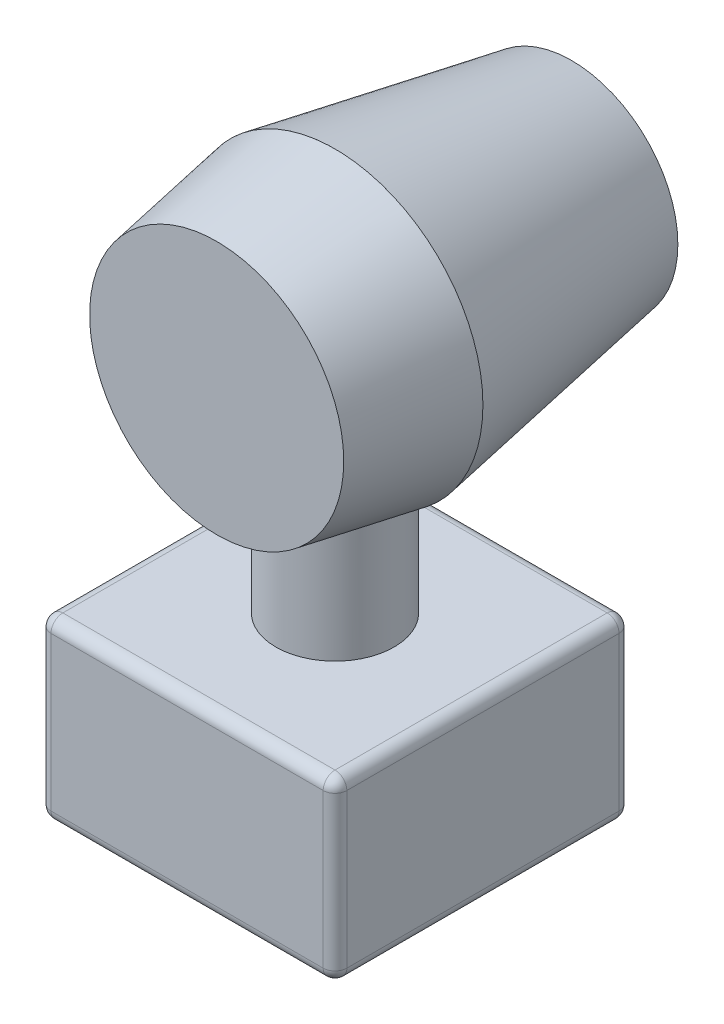
from build123d import *

# Parameters (mm, degrees)
SKETCH1_W           = 63.5
SKETCH1_H           = 38.1
BOSS_EXTRUDE1_DEPTH = 31.75
FILLET1_R           = 2.54
SKETCH2_R           = 12.7
BOSS_EXTRUDE2_DEPTH = 25.4
SKETCH3_R           = 31.75
BOSS_EXTRUDE3_DEPTH = 50.8
BOSS_EXTRUDE3_DRAFT = -10
SKETCH4_R           = 31.75
BOSS_EXTRUDE4_DEPTH = 25.4
BOSS_EXTRUDE4_TAPER = 10


with BuildPart() as part:
    # Sketch1 → Boss-Extrude1 (new, symmetric)
    with BuildSketch(Plane.XY):
        Rectangle(SKETCH1_W, SKETCH1_H)
    extrude(amount=BOSS_EXTRUDE1_DEPTH, both=True)

    # Fillet1
    fillet1_edges = [part.edges().sort_by_distance(p)[0] for p in [
        (-31.75, 0, 31.75),
        (0, -19.05, 31.75),
        (31.75, 0, 31.75),
        (0, -19.05, -31.75),
        (-31.75, 0, -31.75),
        (0, 19.05, -31.75),
        (31.75, 0, -31.75),
        (0, 19.05, 31.75),
        (31.75, -19.05, 0),
        (-31.75, -19.05, 0),
        (-31.75, 19.05, 0),
        (31.75, 19.05, 0),
    ]]
    fillet(fillet1_edges, radius=FILLET1_R)


with BuildPart() as body_2:
    # Sketch2 → Boss-Extrude2 (new body)
    with BuildSketch(Plane(origin=(0, 19.05, 0), x_dir=(-1, 0, 0), z_dir=(0, 1, 0))):
        with Locations(Location((0, 0, 0), (0, 0, 90))):
            Circle(SKETCH2_R)
    extrude(amount=BOSS_EXTRUDE2_DEPTH)


with BuildPart() as boss_extrude3_tool:
    # Sketch3 → Boss-Extrude3 (with draft: the straight prism first)
    with BuildSketch(Plane.XY):
        with Locations((0, 73.549355663)):
            Circle(SKETCH3_R)
    extrude(amount=-BOSS_EXTRUDE3_DEPTH)
    # Boss-Extrude3: the draft: its side faces are tilted about the plane it starts from
    boss_extrude3_sides = [boss_extrude3_tool.faces().sort_by_distance(p)[0] for p in [
        (-31.75, 73.549355663, -25.4),
    ]]
    draft(boss_extrude3_sides, Plane.XY, BOSS_EXTRUDE3_DRAFT)


with BuildPart() as body_2_1:
    add(body_2.part)

    # Boss-Extrude3: add boss_extrude3_tool
    add(boss_extrude3_tool.part)


with BuildPart() as body_3:
    # Sketch4 → Boss-Extrude4 (new body)
    with BuildSketch(Plane.XY):
        with Locations((0, 73.549355663)):
            Circle(SKETCH4_R)
    extrude(amount=BOSS_EXTRUDE4_DEPTH, taper=BOSS_EXTRUDE4_TAPER)


solid = Compound([part.part, body_2_1.part, body_3.part])
